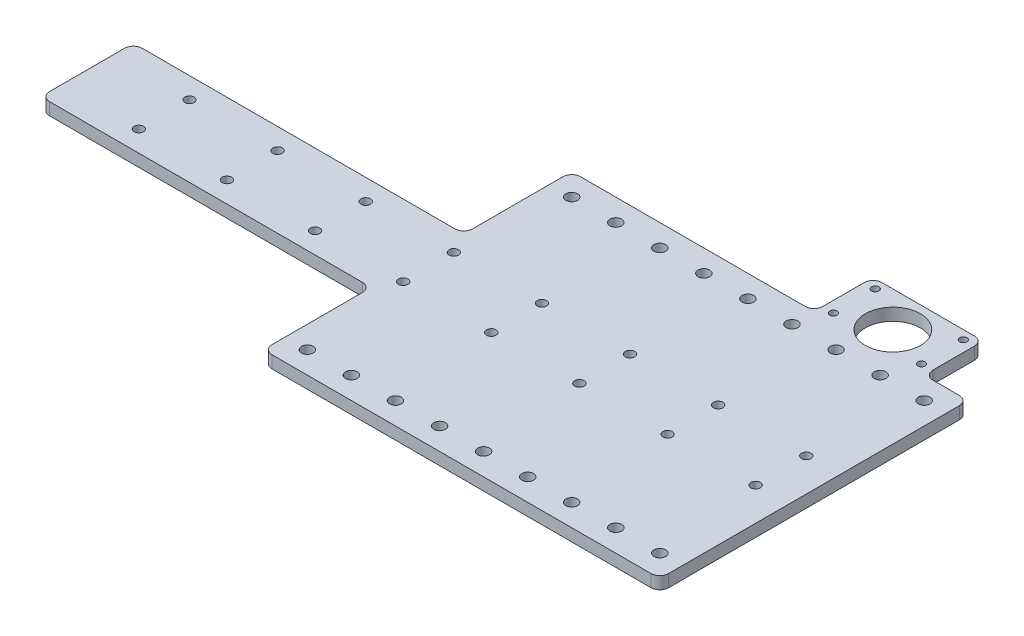
from build123d import *

# Parameters (mm, degrees)
SKETCH1_W           = 180
SKETCH1_H           = 140
BOSS_EXTRUDE1_DEPTH = 5.588
SKETCH3_R           = 2.65
CUT_EXTRUDE2_DEPTH  = 229.103541717
BOSS_EXTRUDE2_DEPTH = 5.588
SKETCH5_R           = 12.5
CUT_EXTRUDE3_DEPTH  = 246.465813799
SKETCH6_R           = 1.65
CUT_EXTRUDE4_DEPTH  = 246.465813799
SKETCH7_W           = 150
SKETCH7_H           = 42
BOSS_EXTRUDE3_DEPTH = 5.588
SKETCH2_R           = 2.15
CUT_EXTRUDE1_DEPTH  = 246.465813799
FILLET1_R           = 4


with BuildPart() as part:
    # Sketch1 → Boss-Extrude1 (new body)
    with BuildSketch(Plane(origin=(0, 0, 0), x_dir=(1, 0, 0), z_dir=(0, 1, 0))):
        with Locations((90, 70)):
            Rectangle(SKETCH1_W, SKETCH1_H)
    extrude(amount=BOSS_EXTRUDE1_DEPTH)

    # Sketch3 → Cut-Extrude2 (cut, through all)
    with BuildSketch(Plane(origin=(0, 5.588, 0), x_dir=(1, 0, 0), z_dir=(0, 1, 0))):
        with Locations(Location((90, 130, 0), (0, 0, 270))):
            Circle(SKETCH3_R)
        with Locations(Location((110, 130, 0), (0, 0, 270))):
            Circle(SKETCH3_R)
        with Locations(Location((130, 130, 0), (0, 0, 270))):
            Circle(SKETCH3_R)
        with Locations(Location((170, 130, 0), (0, 0, 270))):
            Circle(SKETCH3_R)
        with Locations(Location((30, 130, 0), (0, 0, 90))):
            Circle(SKETCH3_R)
        with Locations(Location((150, 130, 0), (0, 0, 270))):
            Circle(SKETCH3_R)
        with Locations(Location((10, 130, 0), (0, 0, 90))):
            Circle(SKETCH3_R)
        with Locations(Location((50, 130, 0), (0, 0, 90))):
            Circle(SKETCH3_R)
        with Locations(Location((70, 130, 0), (0, 0, 90))):
            Circle(SKETCH3_R)
        with Locations(Location((70, 10, 0), (0, 0, 270))):
            Circle(SKETCH3_R)
        with Locations(Location((50, 10, 0), (0, 0, 270))):
            Circle(SKETCH3_R)
        with Locations(Location((10, 10, 0), (0, 0, 270))):
            Circle(SKETCH3_R)
        with Locations(Location((150, 10, 0), (0, 0, 90))):
            Circle(SKETCH3_R)
        with Locations(Location((30, 10, 0), (0, 0, 270))):
            Circle(SKETCH3_R)
        with Locations(Location((170, 10, 0), (0, 0, 90))):
            Circle(SKETCH3_R)
        with Locations(Location((130, 10, 0), (0, 0, 90))):
            Circle(SKETCH3_R)
        with Locations(Location((110, 10, 0), (0, 0, 90))):
            Circle(SKETCH3_R)
        with Locations(Location((90, 10, 0), (0, 0, 90))):
            Circle(SKETCH3_R)
    extrude(amount=-CUT_EXTRUDE2_DEPTH, mode=Mode.SUBTRACT)

    # Sketch4 → Boss-Extrude2 (add, through all)
    with BuildSketch(Plane(origin=(0, 5.588, 0), x_dir=(1, 0, 0), z_dir=(0, 1, 0))):
        with BuildLine():
            Line((160, 140), (141.293647591, 140))
            ThreePointArc((141.293647591, 140), (135, 163.3), (128.706352409, 140))
            Line((128.706352409, 140), (110, 140))
            Line((110, 140), (110, 166.8))
            Line((110, 166.8), (160, 166.8))
            Line((160, 166.8), (160, 140))
        make_face()
    extrude(amount=-BOSS_EXTRUDE2_DEPTH)

    # Sketch5 → Cut-Extrude3 (cut, through all)
    with BuildSketch(Plane(origin=(0, 5.588, 0), x_dir=(1, 0, 0), z_dir=(0, 1, 0))):
        with Locations(Location((135, 150.8, 0), (0, 0, 270))):
            Circle(SKETCH5_R)
    extrude(amount=-CUT_EXTRUDE3_DEPTH, mode=Mode.SUBTRACT)

    # Sketch6 → Cut-Extrude4 (cut, through all)
    with BuildSketch(Plane(origin=(0, 5.588, 0), x_dir=(1, 0, 0), z_dir=(0, 1, 0))):
        with Locations(Location((115, 162.8, 0), (0, 0, 270))):
            Circle(SKETCH6_R)
        with Locations(Location((155, 162.8, 0), (0, 0, 270))):
            Circle(SKETCH6_R)
        with Locations(Location((155, 143.8, 0), (0, 0, 270))):
            Circle(SKETCH6_R)
        with Locations(Location((115, 143.8, 0), (0, 0, 270))):
            Circle(SKETCH6_R)
    extrude(amount=-CUT_EXTRUDE4_DEPTH, mode=Mode.SUBTRACT)

    # Sketch7 → Boss-Extrude3 (add, through all)
    with BuildSketch(Plane(origin=(0, 5.588, 0), x_dir=(1, 0, 0), z_dir=(0, 1, 0))):
        with Locations((-75, 70)):
            Rectangle(SKETCH7_W, SKETCH7_H)
    extrude(amount=-BOSS_EXTRUDE3_DEPTH)

    # Sketch2 → Cut-Extrude1 (cut, through all)
    with BuildSketch(Plane(origin=(0, 5.588, 0), x_dir=(1, 0, 0), z_dir=(0, 1, 0))):
        with Locations(Location((125, 81.5, 0), (0, 0, 270))):
            Circle(SKETCH2_R)
        with Locations(Location((125, 58.5, 0), (0, 0, 270))):
            Circle(SKETCH2_R)
        with Locations(Location((85, 81.5, 0), (0, 0, 270))):
            Circle(SKETCH2_R)
        with Locations(Location((165, 81.5, 0), (0, 0, 270))):
            Circle(SKETCH2_R)
        with Locations(Location((85, 58.5, 0), (0, 0, 270))):
            Circle(SKETCH2_R)
        with Locations(Location((165, 58.5, 0), (0, 0, 270))):
            Circle(SKETCH2_R)
        with Locations(Location((45, 81.5, 0), (0, 0, 270))):
            Circle(SKETCH2_R)
        with Locations(Location((45, 58.5, 0), (0, 0, 270))):
            Circle(SKETCH2_R)
        with Locations(Location((5, 81.5, 0), (0, 0, 270))):
            Circle(SKETCH2_R)
        with Locations(Location((5, 58.5, 0), (0, 0, 270))):
            Circle(SKETCH2_R)
        with Locations(Location((-35, 81.5, 0), (0, 0, 270))):
            Circle(SKETCH2_R)
        with Locations(Location((-35, 58.5, 0), (0, 0, 270))):
            Circle(SKETCH2_R)
        with Locations(Location((-75, 81.5, 0), (0, 0, 270))):
            Circle(SKETCH2_R)
        with Locations(Location((-75, 58.5, 0), (0, 0, 270))):
            Circle(SKETCH2_R)
        with Locations(Location((-115, 81.5, 0), (0, 0, 270))):
            Circle(SKETCH2_R)
        with Locations(Location((-115, 58.5, 0), (0, 0, 270))):
            Circle(SKETCH2_R)
        with Locations((-155, 81.5)):
            Circle(SKETCH2_R)
        with Locations((-155, 58.5)):
            Circle(SKETCH2_R)
    extrude(amount=-CUT_EXTRUDE1_DEPTH, mode=Mode.SUBTRACT)

    # Fillet1
    fillet1_edges = [part.edges().sort_by_distance(p)[0] for p in [
        (0, 2.794, -140),
        (0, 2.794, 0),
        (180, 2.794, 0),
        (180, 2.794, -140),
        (160, 2.794, -140),
        (160, 2.794, -166.8),
        (110, 2.794, -166.8),
        (110, 2.794, -140),
        (0, 2.794, -49),
        (-150, 2.794, -49),
        (-150, 2.794, -91),
        (0, 2.794, -91),
    ]]
    fillet(fillet1_edges, radius=FILLET1_R)


solid = part.part
